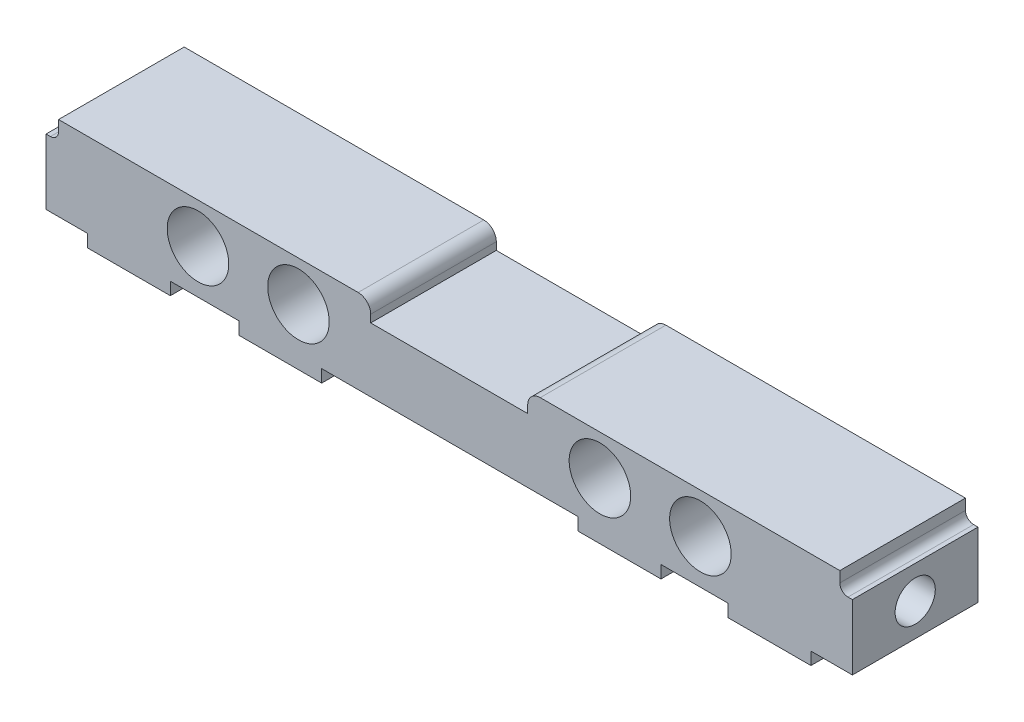
from build123d import *

# Parameters (mm, degrees)
BOSS_EXTRUDE1_DEPTH = 10
SKETCH3_R           = 2.45
CUT_EXTRUDE1_DEPTH  = 11
SKETCH4_R           = 1.6
CUT_EXTRUDE2_DEPTH  = 5
CUT_EXTRUDE3_START  = -5
SKETCH5_R           = 1.6
CUT_EXTRUDE3_DEPTH  = 5
SKETCH6_W           = 12.5
SKETCH6_H           = 1.6
CUT_EXTRUDE4_DEPTH  = 11
FILLET1_R           = 1


with BuildPart() as part:
    # Sketch2 → Boss-Extrude1 (new body)
    with BuildSketch(Plane.XY):
        with BuildLine():
            Line((7.861835452, 3.19), (-7.738161553, 3.19))
            Line((-7.738161553, 3.19), (-31.1, 3.19))
            Line((-31.1, 3.19), (-31.1, 2.34))
            ThreePointArc((-31.1, 2.34), (-31.290380592, 1.880380592), (-31.75, 1.69))
            Line((-31.75, 1.69), (-32.1, 1.69))
            Line((-32.1, 1.69), (-32.1, -3.51))
            Line((-32.1, -3.51), (-28.800002213, -3.51))
            Line((-28.800002213, -3.51), (-28.800002213, -4.51))
            Line((-28.800002213, -4.51), (-22.200001624, -4.51))
            Line((-22.200001624, -4.51), (-22.200001624, -3.51))
            Line((-22.200001624, -3.51), (-16.749999161, -3.51))
            Line((-16.749999161, -3.51), (-16.749999161, -4.51))
            Line((-16.749999161, -4.51), (-10.149998572, -4.51))
            Line((-10.149998572, -4.51), (-10.149998572, -3.51))
            Line((-10.149998572, -3.51), (10.25999916, -3.51))
            Line((10.25999916, -3.51), (10.25999916, -4.51))
            Line((10.25999916, -4.51), (16.85999975, -4.51))
            Line((16.85999975, -4.51), (16.85999975, -3.51))
            Line((16.85999975, -3.51), (22.200001602, -3.51))
            Line((22.200001602, -3.51), (22.200001602, -4.51))
            Line((22.200001602, -4.51), (28.800002191, -4.51))
            Line((28.800002191, -4.51), (28.800002191, -3.51))
            Line((28.800002191, -3.51), (32.1, -3.51))
            Line((32.1, -3.51), (32.1, 1.69))
            Line((32.1, 1.69), (31.75, 1.69))
            ThreePointArc((31.75, 1.69), (31.290380592, 1.880380592), (31.1, 2.34))
            Line((31.1, 2.34), (31.1, 3.19))
            Line((31.1, 3.19), (7.861835452, 3.19))
        make_face()
    extrude(amount=BOSS_EXTRUDE1_DEPTH)

    # Sketch3 → Cut-Extrude1 (cut)
    with BuildSketch(Plane.XY.offset(10)):
        with Locations((-20, 0)):
            Circle(SKETCH3_R)
        with Locations((-12, 0)):
            Circle(SKETCH3_R)
        with Locations((12, 0)):
            Circle(SKETCH3_R)
        with Locations((20, 0)):
            Circle(SKETCH3_R)
    extrude(amount=-CUT_EXTRUDE1_DEPTH, mode=Mode.SUBTRACT)

    # Sketch4 → Cut-Extrude2 (cut)
    with BuildSketch(Plane(origin=(32.1, 0, 0), x_dir=(0, 0, -1), z_dir=(1, 0, 0))):
        with Locations((-5, -0.91)):
            Circle(SKETCH4_R)
    extrude(amount=-CUT_EXTRUDE2_DEPTH, mode=Mode.SUBTRACT)

    # Sketch5 → Cut-Extrude3 (cut)
    with BuildSketch(Plane.ZY.offset(32.1).offset(CUT_EXTRUDE3_START)):
        with Locations(Location((5, -0.91, 0), (0, 0, 180))):
            Circle(SKETCH5_R)
    extrude(amount=CUT_EXTRUDE3_DEPTH, mode=Mode.SUBTRACT)

    # Sketch6 → Cut-Extrude4 (cut)
    with BuildSketch(Plane.XY.offset(10)):
        with Locations((0, 2.39)):
            Rectangle(SKETCH6_W, SKETCH6_H)
    extrude(amount=-CUT_EXTRUDE4_DEPTH, mode=Mode.SUBTRACT)

    # Fillet1
    fillet1_edges = [part.edges().sort_by_distance(p)[0] for p in [
        (6.25, 3.19, 5),
        (-6.25, 3.19, 5),
    ]]
    fillet(fillet1_edges, radius=FILLET1_R)


solid = part.part
